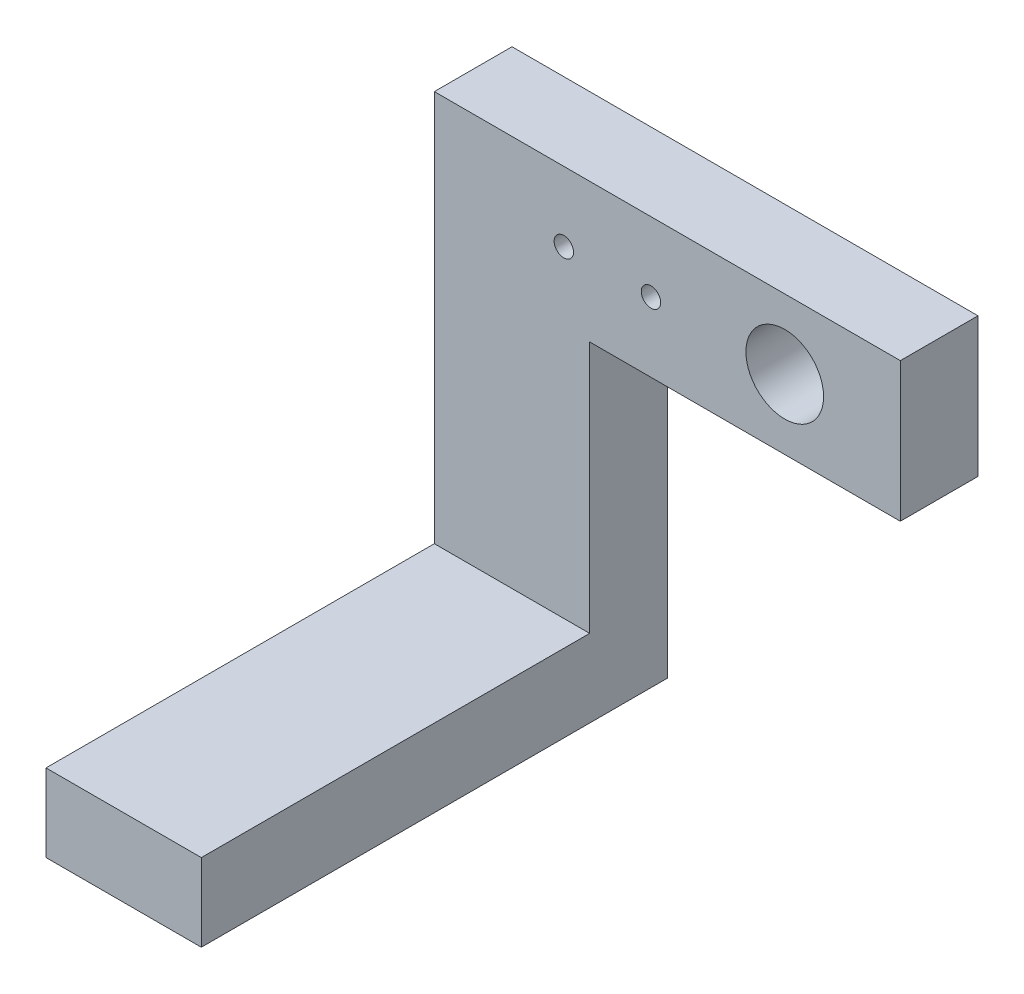
from build123d import *

# Parameters (mm, degrees)
BOSS_EXTRUDE1_DEPTH = 5.08
SKETCH4_W           = 10.16
SKETCH4_H           = 5.08
BOSS_EXTRUDE2_DEPTH = 25.4
SKETCH2_R           = 0.635
SKETCH2_R_2         = 2.54
CUT_EXTRUDE1_DEPTH  = 5.08


with BuildPart() as part:
    # Sketch1 → Boss-Extrude1 (new body)
    with BuildSketch(Plane.XY):
        Polygon((-22.92, -4.55), (-22.92, -26.14), (-12.76, -26.14), (-12.76, -4.55), (7.56, -4.55), (7.56, 4.55), (-22.92, 4.55), align=None)
    extrude(amount=BOSS_EXTRUDE1_DEPTH)

    # Sketch4 → Boss-Extrude2 (add)
    with BuildSketch(Plane.XY.offset(5.08)):
        with Locations((-17.84, -23.6)):
            Rectangle(SKETCH4_W, SKETCH4_H)
    extrude(amount=BOSS_EXTRUDE2_DEPTH)

    # Sketch2 → Cut-Extrude1 (cut)
    with BuildSketch(Plane(origin=(0, 0, 0), x_dir=(-1, 0, 0), z_dir=(0, 0, -1))):
        with Locations((14.45, 0)):
            Circle(SKETCH2_R)
        Circle(SKETCH2_R_2)
        with Locations((8.75, 0)):
            Circle(SKETCH2_R)
    extrude(amount=-CUT_EXTRUDE1_DEPTH, mode=Mode.SUBTRACT)


solid = part.part
